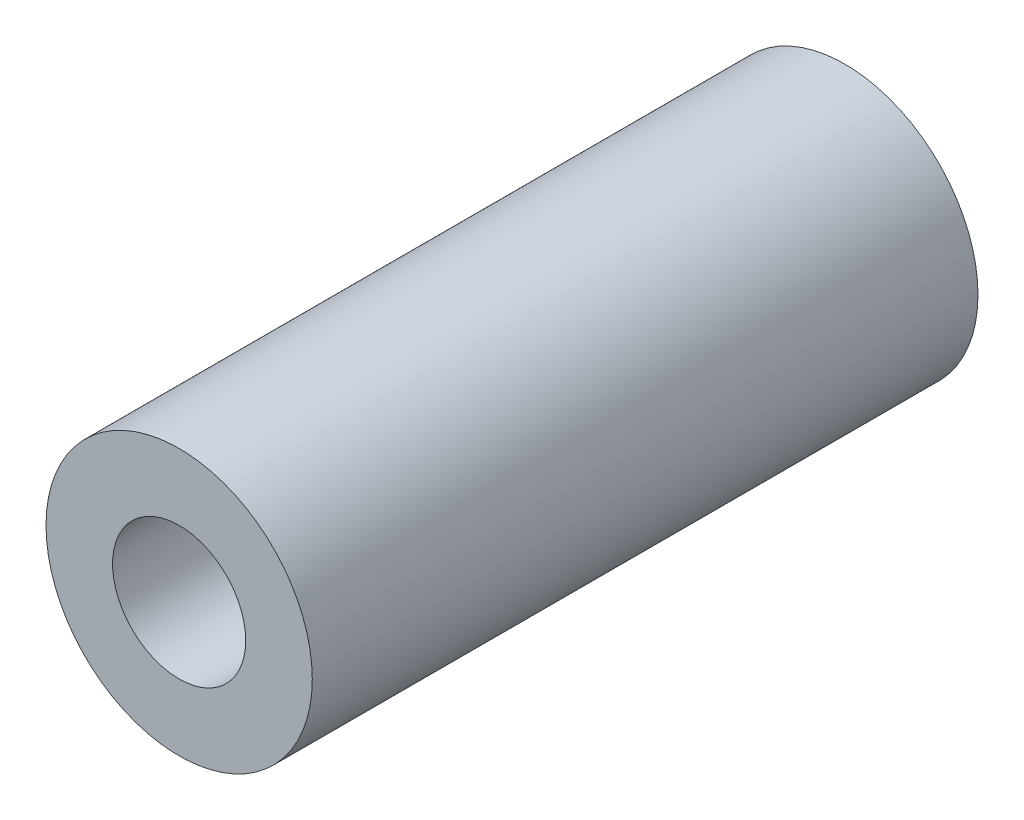
from build123d import *

# Parameters (mm, degrees)
SKETCH_1_R      = 10
SKETCH_1_R_2    = 5
EXTRUDE_1_DEPTH = 50


with BuildPart() as part:
    # 草图1 → 凸台-拉伸1 (new body)
    with BuildSketch(Plane.XY):
        Circle(SKETCH_1_R)
        Circle(SKETCH_1_R_2, mode=Mode.SUBTRACT)
    extrude(amount=EXTRUDE_1_DEPTH)


solid = part.part
